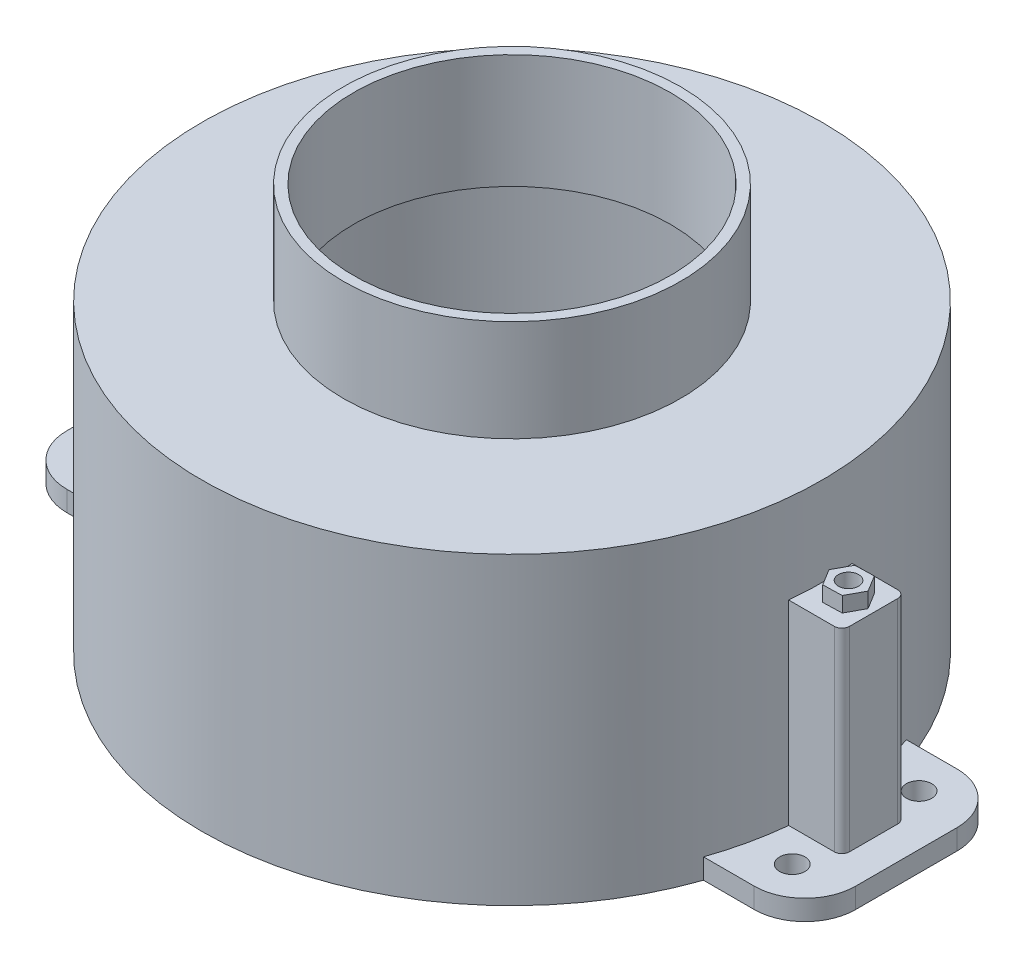
from build123d import *

# Parameters (mm, degrees)
CHAMFER1_SIZE           = 1
CUT_EXTRUDE1_DEPTH      = 236.563420335
CUT_EXTRUDE1_DEPTH_BACK = 236.563420335
BOSS_EXTRUDE2_START     = -160
BOSS_EXTRUDE2_DEPTH     = 85
BOSS_EXTRUDE3_START     = -3
BOSS_EXTRUDE3_DEPTH     = 3
FILLET1_R               = 1.5
FILLET2_R               = 3
FILLET1_OF_MIRROR1_R    = 1.5
FILLET2_OF_MIRROR1_R    = 3
SKETCH6_R               = 5
BOSS_EXTRUDE4_DEPTH     = 8
FILLET3_R               = 20
SKETCH7_R               = 4
CUT_EXTRUDE2_DEPTH      = 10
BOSS_EXTRUDE5_START     = 6
SKETCH8_R               = 4
BOSS_EXTRUDE5_DEPTH     = 6


with BuildPart() as part:
    # Sketch1 → Revolve1 (revolve)
    with BuildSketch(Plane.XY, mode=Mode.PRIVATE) as revolve1_sk:
        Polygon((-122.25, -160), (-118.25, -160), (-118.25, -153), (-115.25, -153), (-115.25, -45), (-62.5, -45), (-62.5, 0), (-66.5, 0), (-66.5, -40), (-122.25, -40), align=None)
    revolve(revolve1_sk.sketch.rotate(Axis((0, -155, 0), (0, 1, 0)), 270), axis=Axis((0, -155, 0), (0, 1, 0)))

    # Chamfer1
    chamfer1_edges = [part.edges().sort_by_distance(p)[0] for p in [
        (0, -153, 115.25),
        (0, -160, 118.25),
    ]]
    chamfer(chamfer1_edges, length=CHAMFER1_SIZE)

    # Sketch3 → Cut-Extrude1 (cut, two sides: drawn at the far end of the back side and taken through both)
    with BuildSketch(Plane(origin=(0, 0, 0), x_dir=(0, 0, -1), z_dir=(1, 0, 0)).offset(-CUT_EXTRUDE1_DEPTH_BACK)):
        with BuildLine():
            Line((-11, -160), (-11, -90))
            ThreePointArc((-11, -90), (0, -79), (11, -90))
            Line((11, -90), (11, -160))
            ThreePointArc((11, -160), (0, -171), (-11, -160))
        make_face()
    extrude(amount=CUT_EXTRUDE1_DEPTH + CUT_EXTRUDE1_DEPTH_BACK, mode=Mode.SUBTRACT)

    # Sketch2 → Boss-Extrude2 (add)
    with BuildSketch(Plane(origin=(34.652885487, 0, -427.94626462), x_dir=(1, 0, 0), z_dir=(0, 1, 0)).offset(BOSS_EXTRUDE2_START)):
        Polygon((107.934581958, -415.44626462), (82.934581958, -415.44626462), (82.934581958, -416.94626462), (106.434581958, -416.94626462), (106.434581958, -438.94626462), (82.934581958, -438.94626462), (82.934581958, -440.44626462), (107.934581958, -440.44626462), align=None)
    boss_extrude2 = extrude(amount=BOSS_EXTRUDE2_DEPTH)

    # Sketch5 → Boss-Extrude3 (add)
    with BuildSketch(Plane(origin=(0, -75, 0), x_dir=(1, 0, 0), z_dir=(0, 1, 0)).offset(BOSS_EXTRUDE3_START)):
        with BuildLine():
            Line((141.087467444, -11), (141.087467444, 11))
            Line((141.087467444, 11), (121.754106707, 11))
            ThreePointArc((121.754106707, 11), (122.125963752, 5.505586031), (122.25, 0))
            ThreePointArc((122.25, 0), (122.125963752, -5.505586031), (121.754106707, -11))
            Line((121.754106707, -11), (141.087467444, -11))
        make_face()
    boss_extrude3 = extrude(amount=BOSS_EXTRUDE3_DEPTH)

    # Fillet1
    fillet1_edges = [part.edges().sort_by_distance(p)[0] for p in [
        (141.087467444, -119, 11),
        (141.087467444, -119, -11),
    ]]
    fillet(fillet1_edges, radius=FILLET1_R)

    # Fillet2
    fillet2_edges = [part.edges().sort_by_distance(p)[0] for p in [
        (142.587467444, -117.5, 12.5),
        (142.587467444, -117.5, -12.5),
    ]]
    fillet(fillet2_edges, radius=FILLET2_R)

    # Mirror1: Boss-Extrude2, Boss-Extrude3 across plane
    add(boss_extrude2.mirror(Plane(origin=(0, 0, 0), x_dir=(0, 0, 1), z_dir=(1, 0, 0))))
    add(boss_extrude3.mirror(Plane(origin=(0, 0, 0), x_dir=(0, 0, 1), z_dir=(1, 0, 0))))

    # Fillet1 of Mirror1
    fillet1_of_mirror1_edges = [part.edges().sort_by_distance(p)[0] for p in [
        (-141.087467444, -119, 11),
        (-141.087467444, -119, -11),
    ]]
    fillet(fillet1_of_mirror1_edges, radius=FILLET1_OF_MIRROR1_R)

    # Fillet2 of Mirror1
    fillet2_of_mirror1_edges = [part.edges().sort_by_distance(p)[0] for p in [
        (-142.587467444, -117.5, 12.5),
        (-142.587467444, -117.5, -12.5),
    ]]
    fillet(fillet2_of_mirror1_edges, radius=FILLET2_OF_MIRROR1_R)

    # Sketch6 → Boss-Extrude4 (add)
    # profile 1 of 2: a face of its own
    with BuildSketch(Plane.XZ.offset(160)):
        with BuildLine():
            Line((-155.520831455, 40), (-155.520831455, -40))
            Line((-155.520831455, -40), (-115.520831455, -40))
            ThreePointArc((-115.520831455, -40), (-119.359678094, -26.425929413), (-121.609261572, -12.5))
            Line((-121.609261572, -12.5), (-139.587467444, -12.5))
            ThreePointArc((-139.587467444, -12.5), (-141.708787788, -11.621320344), (-142.587467444, -9.5))
            Line((-142.587467444, -9.5), (-142.587467444, 9.5))
            ThreePointArc((-142.587467444, 9.5), (-141.708787788, 11.621320344), (-139.587467444, 12.5))
            Line((-139.587467444, 12.5), (-121.609261572, 12.5))
            ThreePointArc((-121.609261572, 12.5), (-119.359678094, 26.425929413), (-115.520831455, 40))
            Line((-115.520831455, 40), (-155.520831455, 40))
        make_face()
        with Locations(Location((-135.520831455, -25, 0), (0, 0, 270))):
            Circle(SKETCH6_R, mode=Mode.SUBTRACT)
        with Locations(Location((-135.520831455, 25, 0), (0, 0, 270))):
            Circle(SKETCH6_R, mode=Mode.SUBTRACT)
    # profile 2 of 2: a face of its own
    with BuildSketch(Plane.XZ.offset(160)):
        with BuildLine():
            ThreePointArc((121.609261572, -12.5), (119.359678094, -26.425929413), (115.520831455, -40))
            Line((115.520831455, -40), (155.520831455, -40))
            Line((155.520831455, -40), (155.520831455, 40))
            Line((155.520831455, 40), (115.520831455, 40))
            ThreePointArc((115.520831455, 40), (119.359678094, 26.425929413), (121.609261572, 12.5))
            Line((121.609261572, 12.5), (139.587467444, 12.5))
            ThreePointArc((139.587467444, 12.5), (141.708787788, 11.621320344), (142.587467444, 9.5))
            Line((142.587467444, 9.5), (142.587467444, -9.5))
            ThreePointArc((142.587467444, -9.5), (141.708787788, -11.621320344), (139.587467444, -12.5))
            Line((139.587467444, -12.5), (121.609261572, -12.5))
        make_face()
        with Locations(Location((135.520831455, -25, 0), (0, 0, 270))):
            Circle(SKETCH6_R, mode=Mode.SUBTRACT)
        with Locations(Location((135.520831455, 25, 0), (0, 0, 270))):
            Circle(SKETCH6_R, mode=Mode.SUBTRACT)
    extrude(amount=-BOSS_EXTRUDE4_DEPTH)

    # Fillet3
    fillet3_edges = [part.edges().sort_by_distance(p)[0] for p in [
        (-155.520831455, -156, 40),
        (-155.520831455, -156, -40),
        (155.520831455, -156, -40),
        (155.520831455, -156, 40),
    ]]
    fillet(fillet3_edges, radius=FILLET3_R)

    # Sketch7 → Cut-Extrude2 (cut)
    with BuildSketch(Plane(origin=(0, -75, 0), x_dir=(1, 0, 0), z_dir=(0, 1, 0))):
        with Locations(Location((-132.699855766, 0, 0), (0, 0, 270))):
            Circle(SKETCH7_R)
    cut_extrude2 = extrude(amount=-CUT_EXTRUDE2_DEPTH, mode=Mode.SUBTRACT)

    # Sketch8 → Boss-Extrude5 (add)
    with BuildSketch(Plane(origin=(0, -75, 0), x_dir=(1, 0, 0), z_dir=(0, 1, 0)).offset(BOSS_EXTRUDE5_START)):
        Polygon((-128.770701066, 6.394925854), (-136.273446661, 6.600210713), (-140.202601361, 0.205284859), (-136.629010467, -6.394925854), (-129.126264872, -6.600210713), (-125.197110172, -0.205284859), align=None)
        with Locations(Location((-132.699855766, 0, 0), (0, 0, 270))):
            Circle(SKETCH8_R, mode=Mode.SUBTRACT)
    boss_extrude5 = extrude(amount=-BOSS_EXTRUDE5_DEPTH)

    # Mirror2: Cut-Extrude2, Boss-Extrude5 across plane
    add(cut_extrude2.mirror(Plane(origin=(0, 0, 0), x_dir=(0, 0, 1), z_dir=(1, 0, 0))), mode=Mode.SUBTRACT)
    add(boss_extrude5.mirror(Plane(origin=(0, 0, 0), x_dir=(0, 0, 1), z_dir=(1, 0, 0))))


solid = part.part
